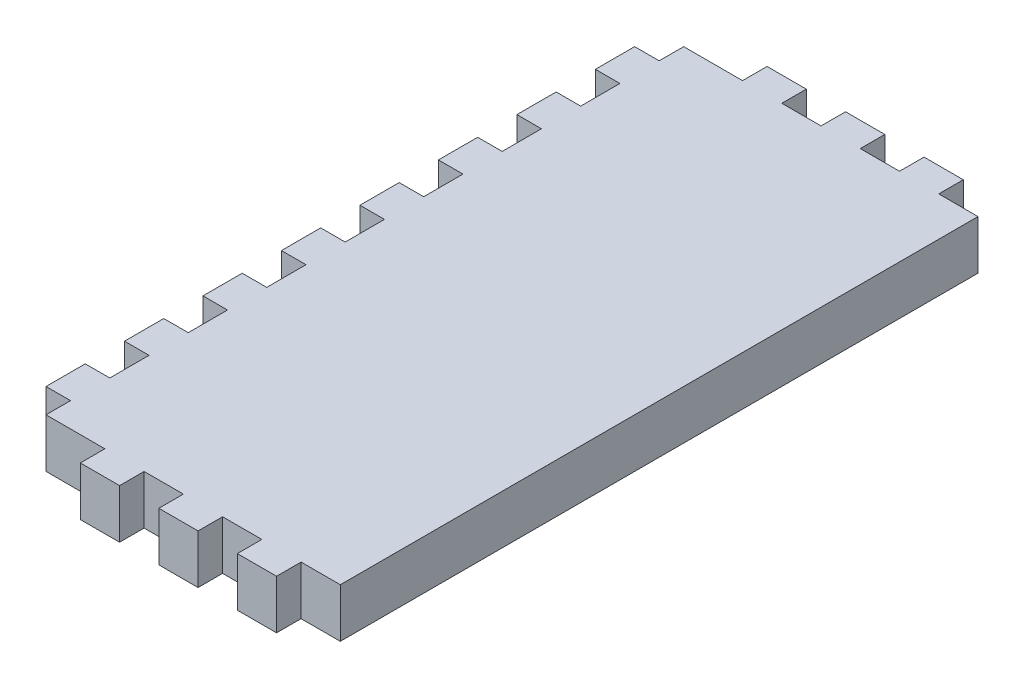
from build123d import *

# Parameters (mm, degrees)
SKETCH1_W           = 38.1
SKETCH1_H           = 82.55
BOSS_EXTRUDE1_DEPTH = 6.35
SKETCH2_W           = 5.08
SKETCH2_H           = 3.175
SKETCH2_W_2         = 3.175
SKETCH2_H_2         = 5.08
BOSS_EXTRUDE2_DEPTH = 6.35


with BuildPart() as part:
    # Sketch1 → Boss-Extrude1 (new body)
    with BuildSketch(Plane(origin=(0, 0, 0), x_dir=(1, 0, 0), z_dir=(0, 1, 0))):
        Rectangle(SKETCH1_W, SKETCH1_H)
    extrude(amount=BOSS_EXTRUDE1_DEPTH)

    # Sketch2 → Boss-Extrude2 (add)
    with BuildSketch(Plane(origin=(0, 0, 0), x_dir=(-1, 0, 0), z_dir=(0, -1, 0))):
        with Locations((-11.43, 42.8625)):
            Rectangle(SKETCH2_W, SKETCH2_H)
        with Locations((20.6375, 35.56)):
            Rectangle(SKETCH2_W_2, SKETCH2_H_2)
        with Locations((-1.27, 42.8625)):
            Rectangle(SKETCH2_W, SKETCH2_H)
        with Locations((8.89, 42.8625)):
            Rectangle(SKETCH2_W, SKETCH2_H)
        with Locations((20.6375, 25.4)):
            Rectangle(SKETCH2_W_2, SKETCH2_H_2)
        with Locations((20.6375, 15.24)):
            Rectangle(SKETCH2_W_2, SKETCH2_H_2)
        with Locations((20.6375, 5.08)):
            Rectangle(SKETCH2_W_2, SKETCH2_H_2)
        with Locations((20.6375, -5.08)):
            Rectangle(SKETCH2_W_2, SKETCH2_H_2)
        with Locations((20.6375, -15.24)):
            Rectangle(SKETCH2_W_2, SKETCH2_H_2)
        with Locations((20.6375, -25.4)):
            Rectangle(SKETCH2_W_2, SKETCH2_H_2)
        with Locations((20.6375, -35.56)):
            Rectangle(SKETCH2_W_2, SKETCH2_H_2)
        with Locations((8.89, -42.8625)):
            Rectangle(SKETCH2_W, SKETCH2_H)
        with Locations((-1.27, -42.8625)):
            Rectangle(SKETCH2_W, SKETCH2_H)
        with Locations((-11.43, -42.8625)):
            Rectangle(SKETCH2_W, SKETCH2_H)
    extrude(amount=-BOSS_EXTRUDE2_DEPTH)


solid = part.part
